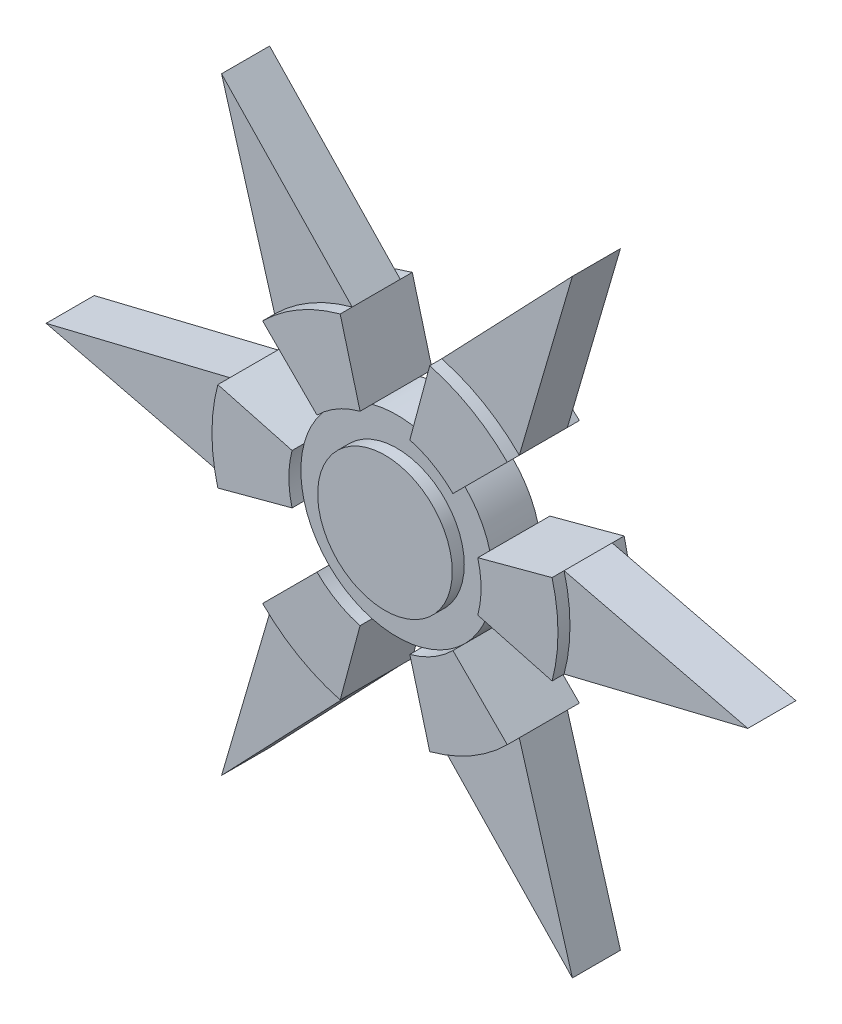
from build123d import *

# Parameters (mm, degrees)
BOSS_EXTRUDE1_DEPTH   = 7.5
BOSS_EXTRUDE1_2_DEPTH = 7.5
BOSS_EXTRUDE1_3_DEPTH = 7.5
BOSS_EXTRUDE1_4_DEPTH = 7.5
BOSS_EXTRUDE1_5_DEPTH = 7.5
BOSS_EXTRUDE1_6_DEPTH = 7.5
SKETCH1_R             = 14
BOSS_EXTRUDE1_7_DEPTH = 7.5
SKETCH1_3_R           = 20
SKETCH1_3_R_2         = 14
BOSS_EXTRUDE2_DEPTH   = 5


with BuildPart() as part:
    # Sketch1 → Boss-Extrude1 (new, symmetric)
    with BuildSketch(Plane.XY):
        with BuildLine():
            ThreePointArc((34.773329746, -9.317485624), (36, 0), (34.773329746, 9.317485624))
            Line((34.773329746, 9.317485624), (19.318516526, 5.176380902))
            ThreePointArc((19.318516526, 5.176380902), (20, 0), (19.318516526, -5.176380902))
            Line((19.318516526, -5.176380902), (34.773329746, -9.317485624))
        make_face()
    extrude(amount=BOSS_EXTRUDE1_DEPTH, both=True)



with BuildPart() as body_2:
    # Sketch1 → Boss-Extrude1 2 (new, symmetric)
    with BuildSketch(Plane.XY):
        with BuildLine():
            Line((14.142135624, 14.142135624), (25.455844123, 25.455844123))
            ThreePointArc((25.455844123, 25.455844123), (18, 31.176914536), (9.317485624, 34.773329746))
            Line((9.317485624, 34.773329746), (5.176380902, 19.318516526))
            ThreePointArc((5.176380902, 19.318516526), (10, 17.320508076), (14.142135624, 14.142135624))
        make_face()
    extrude(amount=BOSS_EXTRUDE1_2_DEPTH, both=True)


with BuildPart() as body_3:
    # Sketch1 → Boss-Extrude1 3 (new, symmetric)
    with BuildSketch(Plane.XY):
        with BuildLine():
            ThreePointArc((9.317485624, -34.773329746), (18, -31.176914536), (25.455844123, -25.455844123))
            Line((25.455844123, -25.455844123), (14.142135624, -14.142135624))
            ThreePointArc((14.142135624, -14.142135624), (10, -17.320508076), (5.176380902, -19.318516526))
            Line((5.176380902, -19.318516526), (9.317485624, -34.773329746))
        make_face()
    extrude(amount=BOSS_EXTRUDE1_3_DEPTH, both=True)


with BuildPart() as body_4:
    # Sketch1 → Boss-Extrude1 4 (new, symmetric)
    with BuildSketch(Plane.XY):
        with BuildLine():
            Line((-5.176380902, 19.318516526), (-9.317485624, 34.773329746))
            ThreePointArc((-9.317485624, 34.773329746), (-18, 31.176914536), (-25.455844123, 25.455844123))
            Line((-25.455844123, 25.455844123), (-14.142135624, 14.142135624))
            ThreePointArc((-14.142135624, 14.142135624), (-10, 17.320508076), (-5.176380902, 19.318516526))
        make_face()
    extrude(amount=BOSS_EXTRUDE1_4_DEPTH, both=True)


with BuildPart() as body_5:
    # Sketch1 → Boss-Extrude1 5 (new, symmetric)
    with BuildSketch(Plane.XY):
        with BuildLine():
            ThreePointArc((-25.455844123, -25.455844123), (-18, -31.176914536), (-9.317485624, -34.773329746))
            Line((-9.317485624, -34.773329746), (-5.176380902, -19.318516526))
            ThreePointArc((-5.176380902, -19.318516526), (-10, -17.320508076), (-14.142135624, -14.142135624))
            Line((-14.142135624, -14.142135624), (-25.455844123, -25.455844123))
        make_face()
    extrude(amount=BOSS_EXTRUDE1_5_DEPTH, both=True)


with BuildPart() as body_6:
    # Sketch1 → Boss-Extrude1 6 (new, symmetric)
    with BuildSketch(Plane.XY):
        with BuildLine():
            Line((-19.318516526, 5.176380902), (-34.773329746, 9.317485624))
            ThreePointArc((-34.773329746, 9.317485624), (-36, 0), (-34.773329746, -9.317485624))
            Line((-34.773329746, -9.317485624), (-19.318516526, -5.176380902))
            ThreePointArc((-19.318516526, -5.176380902), (-20, 0), (-19.318516526, 5.176380902))
        make_face()
    extrude(amount=BOSS_EXTRUDE1_6_DEPTH, both=True)


with BuildPart() as body_7:
    # Sketch1 → Boss-Extrude1 7 (new, symmetric)
    with BuildSketch(Plane.XY):
        Circle(SKETCH1_R)
    extrude(amount=BOSS_EXTRUDE1_7_DEPTH, both=True)


with BuildPart() as part_1:
    add(part.part)

    add(body_2.part)  # Boss-Extrude2 merges body 2

    add(body_3.part)  # Boss-Extrude2 merges body 3

    add(body_4.part)  # Boss-Extrude2 merges body 4

    add(body_5.part)  # Boss-Extrude2 merges body 5

    add(body_6.part)  # Boss-Extrude2 merges body 6

    add(body_7.part)  # Boss-Extrude2 merges body 7
    # Sketch1<3> → Boss-Extrude2 (add, symmetric)
    # profile 1 of 7: a face of its own
    with BuildSketch(Plane.XY):
        with BuildLine():
            Line((73, 0), (34.773329746, 9.317485624))
            ThreePointArc((34.773329746, 9.317485624), (36, 0), (34.773329746, -9.317485624))
            Line((34.773329746, -9.317485624), (73, 0))
        make_face()
    # profile 2 of 7: a face of its own
    with BuildSketch(Plane.XY):
        Circle(SKETCH1_3_R)
        Circle(SKETCH1_3_R_2, mode=Mode.SUBTRACT)
    # profile 3 of 7: a face of its own
    with BuildSketch(Plane.XY):
        with BuildLine():
            ThreePointArc((9.317485624, 34.773329746), (18, 31.176914536), (25.455844123, 25.455844123))
            Line((25.455844123, 25.455844123), (36.5, 63.219854476))
            Line((36.5, 63.219854476), (9.317485624, 34.773329746))
        make_face()
    # profile 4 of 7: a face of its own
    with BuildSketch(Plane.XY):
        with BuildLine():
            Line((36.5, -63.219854476), (25.455844123, -25.455844123))
            ThreePointArc((25.455844123, -25.455844123), (18, -31.176914536), (9.317485624, -34.773329746))
            Line((9.317485624, -34.773329746), (36.5, -63.219854476))
        make_face()
    # profile 5 of 7: a face of its own
    with BuildSketch(Plane.XY):
        with BuildLine():
            ThreePointArc((-25.455844123, 25.455844123), (-18, 31.176914536), (-9.317485624, 34.773329746))
            Line((-9.317485624, 34.773329746), (-36.5, 63.219854476))
            Line((-36.5, 63.219854476), (-25.455844123, 25.455844123))
        make_face()
    # profile 6 of 7: a face of its own
    with BuildSketch(Plane.XY):
        with BuildLine():
            Line((-36.5, -63.219854476), (-9.317485624, -34.773329746))
            ThreePointArc((-9.317485624, -34.773329746), (-18, -31.176914536), (-25.455844123, -25.455844123))
            Line((-25.455844123, -25.455844123), (-36.5, -63.219854476))
        make_face()
    # profile 7 of 7: a face of its own
    with BuildSketch(Plane.XY):
        with BuildLine():
            ThreePointArc((-34.773329746, -9.317485624), (-36, 0), (-34.773329746, 9.317485624))
            Line((-34.773329746, 9.317485624), (-73, 0))
            Line((-73, 0), (-34.773329746, -9.317485624))
        make_face()
    extrude(amount=BOSS_EXTRUDE2_DEPTH, both=True)


solid = part_1.part
